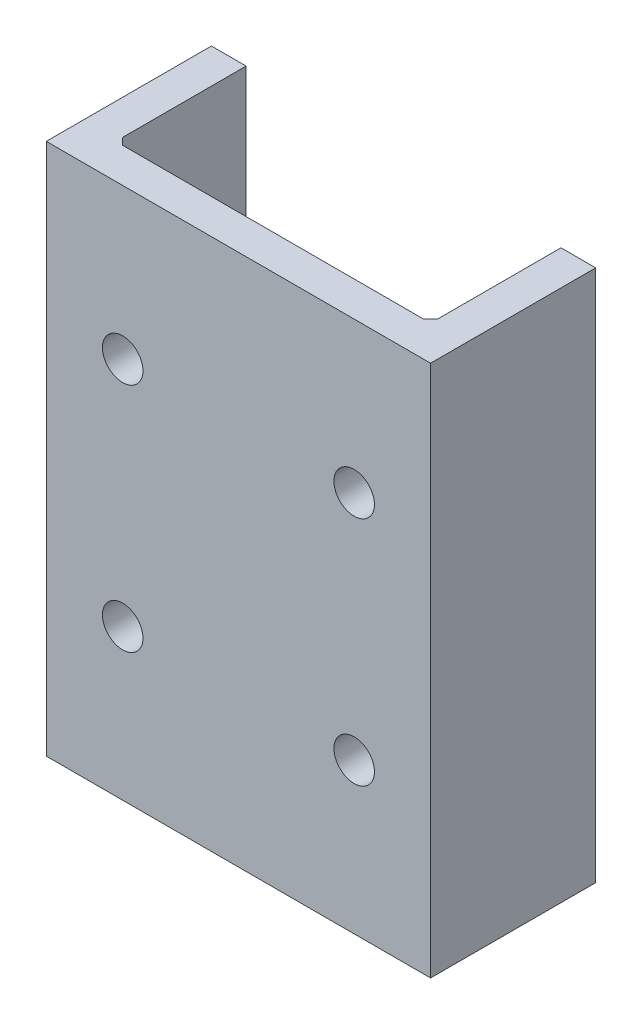
from build123d import *

# Parameters (mm, degrees)
BOSS_EXTRU_1_DEPTH      = 46
ENL_V_MAT_EXTRU_1_REACH = 52.942
ESQUISSE2_R             = 1.75


with BuildPart() as part:
    # Esquisse1 → Boss.-Extru.1 (new body)
    with BuildSketch(Plane(origin=(0, 0, 0), x_dir=(1, 0, 0), z_dir=(0, 1, 0))):
        Polygon((-13.6, 11.266030534), (-13.6, 0.6), (-13, 0), (13, 0), (13.6, 0.6), (13.6, 11.266030534), (16.6, 11.266030534), (16.6, -3), (-16.6, -3), (-16.6, 11.266030534), align=None)
    extrude(amount=BOSS_EXTRU_1_DEPTH)

    # Esquisse2 → Enlèv. mat.-Extru.1 (cut, up to next)
    with BuildSketch(Plane.XY.offset(3), mode=Mode.PRIVATE) as enl_v_mat_extru_1_sk1:
        with Locations((-10, 33)):
            Circle(ESQUISSE2_R)
    enl_v_mat_extru_1_tool1 = extrude(enl_v_mat_extru_1_sk1.sketch, amount=-ENL_V_MAT_EXTRU_1_REACH, mode=Mode.PRIVATE) & part.part
    # Esquisse2 → Enlèv. mat.-Extru.1 (cut, up to next)
    with BuildSketch(Plane.XY.offset(3), mode=Mode.PRIVATE) as enl_v_mat_extru_1_sk2:
        with Locations((10, 33)):
            Circle(ESQUISSE2_R)
    enl_v_mat_extru_1_tool2 = extrude(enl_v_mat_extru_1_sk2.sketch, amount=-ENL_V_MAT_EXTRU_1_REACH, mode=Mode.PRIVATE) & part.part
    # Esquisse2 → Enlèv. mat.-Extru.1 (cut, up to next)
    with BuildSketch(Plane.XY.offset(3), mode=Mode.PRIVATE) as enl_v_mat_extru_1_sk3:
        with Locations((10, 13)):
            Circle(ESQUISSE2_R)
    enl_v_mat_extru_1_tool3 = extrude(enl_v_mat_extru_1_sk3.sketch, amount=-ENL_V_MAT_EXTRU_1_REACH, mode=Mode.PRIVATE) & part.part
    # Esquisse2 → Enlèv. mat.-Extru.1 (cut, up to next)
    with BuildSketch(Plane.XY.offset(3), mode=Mode.PRIVATE) as enl_v_mat_extru_1_sk4:
        with Locations((-10, 13)):
            Circle(ESQUISSE2_R)
    enl_v_mat_extru_1_tool4 = extrude(enl_v_mat_extru_1_sk4.sketch, amount=-ENL_V_MAT_EXTRU_1_REACH, mode=Mode.PRIVATE) & part.part
    add(enl_v_mat_extru_1_tool1.solids().sort_by_distance((-10, 33, 3))[0], mode=Mode.SUBTRACT)
    add(enl_v_mat_extru_1_tool2.solids().sort_by_distance((10, 33, 3))[0], mode=Mode.SUBTRACT)
    add(enl_v_mat_extru_1_tool3.solids().sort_by_distance((10, 13, 3))[0], mode=Mode.SUBTRACT)
    add(enl_v_mat_extru_1_tool4.solids().sort_by_distance((-10, 13, 3))[0], mode=Mode.SUBTRACT)


solid = part.part
